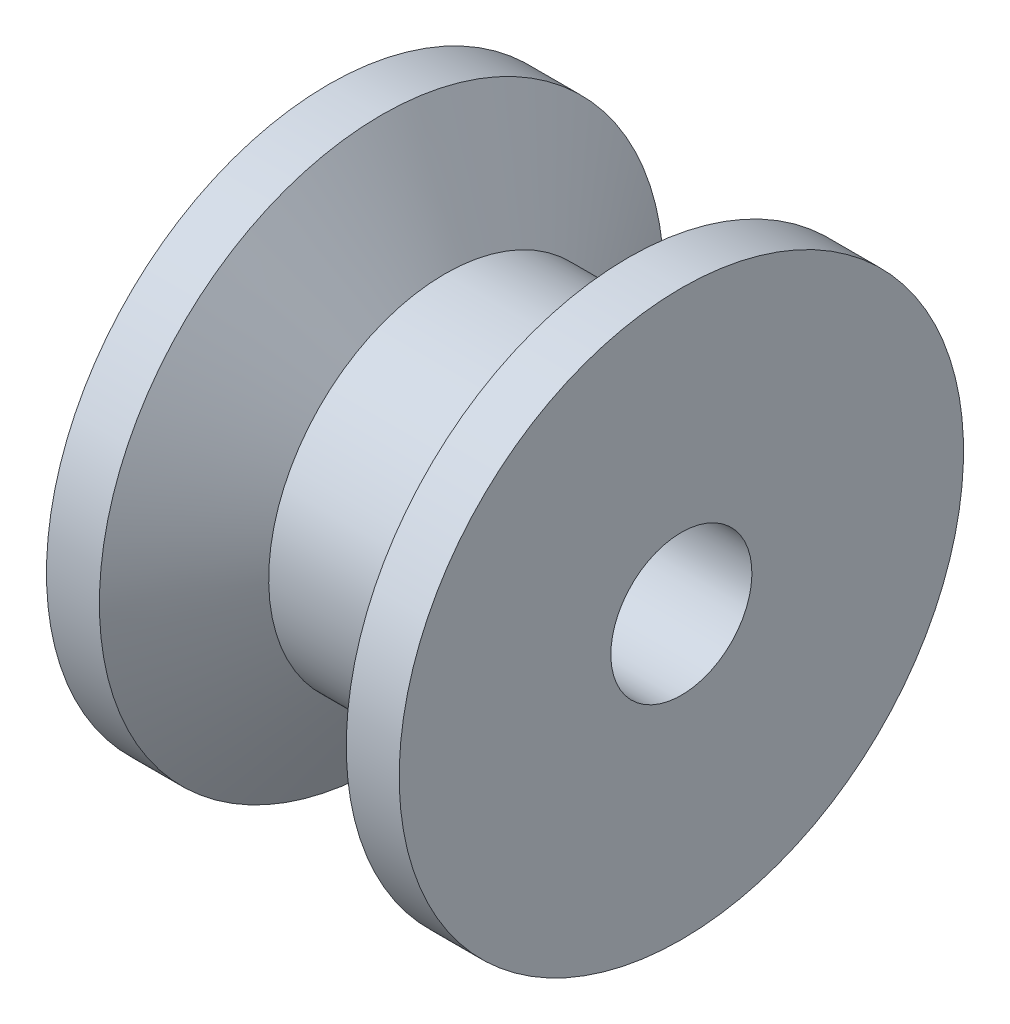
from build123d import *

# Parameters (mm, degrees)
SKETCH_2_R          = 20
CUT_EXTRUDE_1_DEPTH = 156.541574118


with BuildPart() as part:
    # 草图1 → 旋转1 (revolve)
    with BuildSketch(Plane.XY):
        Polygon((-114.203007519, 8.278996818), (-114.203007519, 88.278996818), (-99.203007519, 88.278996818), (-81.203007519, 58.278996818), (-47.203007519, 58.278996818), (-29.203007519, 88.278996818), (-14.203007519, 88.278996818), (-14.203007519, 8.278996818), align=None)
    revolve(axis=Axis((-14.203007519, 8.278996818, 0), (-1, 0, 0)))

    # 草图2 → 切除-拉伸1 (cut, through all)
    with BuildSketch(Plane(origin=(-14.203007519, 0, 0), x_dir=(0, 0, -1), z_dir=(1, 0, 0))):
        with Locations(Location((0, 8.278996818, 0), (0, 0, 90))):
            Circle(SKETCH_2_R)
    extrude(amount=-CUT_EXTRUDE_1_DEPTH, mode=Mode.SUBTRACT)


solid = part.part
